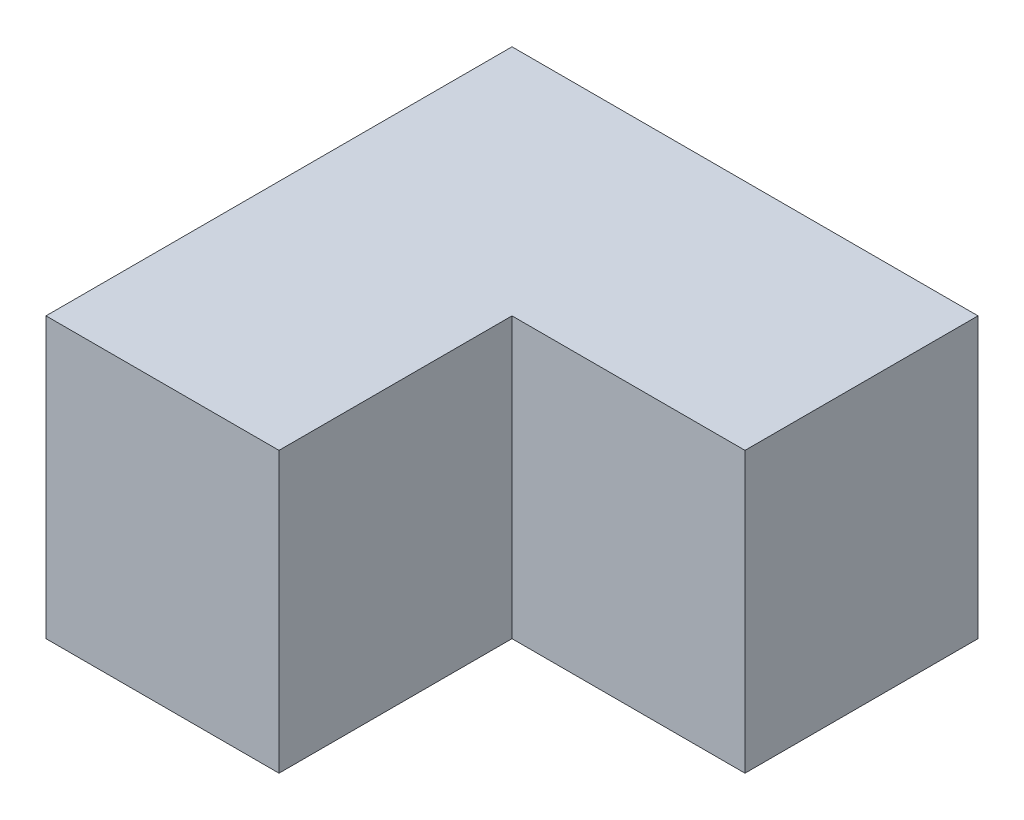
from build123d import *

# Parameters (mm, degrees)
SKETCH1_W           = 30
SKETCH1_H           = 30
BOSS_EXTRUDE1_DEPTH = 18
SKETCH2_W           = 15
SKETCH2_H           = 15
CUT_EXTRUDE1_DEPTH  = 28.820855486


with BuildPart() as part:
    # Sketch1 → Boss-Extrude1 (new body)
    with BuildSketch(Plane(origin=(0, 0, 0), x_dir=(1, 0, 0), z_dir=(0, 1, 0))):
        Rectangle(SKETCH1_W, SKETCH1_H)
    extrude(amount=BOSS_EXTRUDE1_DEPTH)

    # Sketch2 → Cut-Extrude1 (cut, through all)
    with BuildSketch(Plane(origin=(0, 18, 0), x_dir=(1, 0, 0), z_dir=(0, 1, 0))):
        with Locations((7.5, -7.5)):
            Rectangle(SKETCH2_W, SKETCH2_H)
    extrude(amount=-CUT_EXTRUDE1_DEPTH, mode=Mode.SUBTRACT)


solid = part.part
